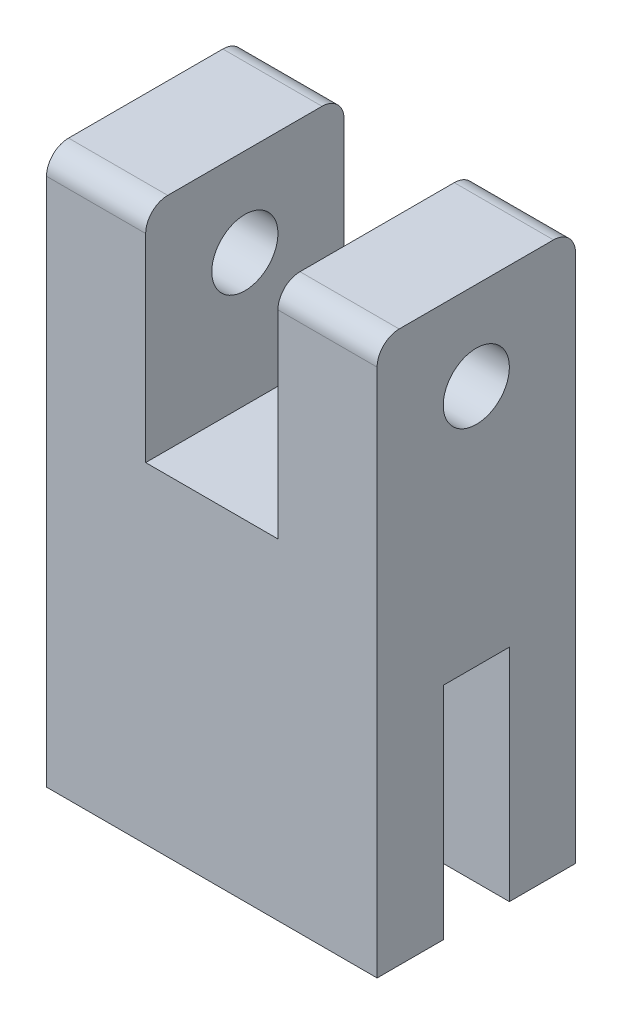
from build123d import *

# Parameters (mm, degrees)
CROQUIS2_W                 = 15
CROQUIS2_H                 = 15
SALIENTE_EXTRUIR1_DEPTH    = 4.5
CROQUIS3_W                 = 15
CROQUIS3_H                 = 10
CORTAR_EXTRUIR1_DEPTH      = 1.5
CORTAR_EXTRUIR2_DEPTH      = 12.521718622
CROQUIS10_W                = 4.5
CROQUIS10_H                = 9
SALIENTE_EXTRUIR4_DEPTH    = 10
CORTAR_EXTRUIR3_DEPTH      = 20.563997547
CORTAR_EXTRUIR3_DEPTH_BACK = 20.563997547
CROQUIS7_R                 = 1.5
REDONDEO2_R                = 1


with BuildPart() as part:
    # Croquis2 → Saliente-Extruir1 (new, symmetric)
    with BuildSketch(Plane.XY):
        Rectangle(CROQUIS2_W, CROQUIS2_H)
    extrude(amount=SALIENTE_EXTRUIR1_DEPTH, both=True)

    # Croquis3 → Cortar-Extruir1 (cut, symmetric)
    with BuildSketch(Plane.XY):
        with Locations((0, -2.5)):
            Rectangle(CROQUIS3_W, CROQUIS3_H)
    extrude(amount=CORTAR_EXTRUIR1_DEPTH, both=True, mode=Mode.SUBTRACT)

    # Croquis4 → Cortar-Extruir2 (cut, through all)
    with BuildSketch(Plane.XY):
        with BuildLine():
            Line((-1.5, 0), (-1.5, -7.5))
            Line((-1.5, -7.5), (1.5, -7.5))
            Line((1.5, -7.5), (1.5, 0))
            ThreePointArc((1.5, 0), (0, 1.5), (-1.5, 0))
        make_face()
    extrude(amount=-CORTAR_EXTRUIR2_DEPTH, mode=Mode.SUBTRACT)

    # Croquis10 → Saliente-Extruir4 (add)
    with BuildSketch(Plane(origin=(0, 7.5, 0), x_dir=(1, 0, 0), z_dir=(0, 1, 0))):
        with Locations((-5.25, 0)):
            Rectangle(CROQUIS10_W, CROQUIS10_H)
        with Locations((5.25, 0)):
            Rectangle(CROQUIS10_W, CROQUIS10_H)
    extrude(amount=SALIENTE_EXTRUIR4_DEPTH)

    # Croquis7 → Cortar-Extruir3 (cut, two sides: drawn at the far end of the back side and taken through both)
    with BuildSketch(Plane(origin=(0, 0, 0), x_dir=(0, 0, -1), z_dir=(1, 0, 0)).offset(-CORTAR_EXTRUIR3_DEPTH_BACK)):
        with Locations((0, 13.5)):
            Circle(CROQUIS7_R)
    extrude(amount=CORTAR_EXTRUIR3_DEPTH + CORTAR_EXTRUIR3_DEPTH_BACK, mode=Mode.SUBTRACT)

    # Redondeo2
    redondeo2_edges = [part.edges().sort_by_distance(p)[0] for p in [
        (5.25, 17.5, -4.5),
        (5.25, 17.5, 4.5),
        (-5.25, 17.5, 4.5),
        (-5.25, 17.5, -4.5),
    ]]
    fillet(redondeo2_edges, radius=REDONDEO2_R)


solid = part.part
